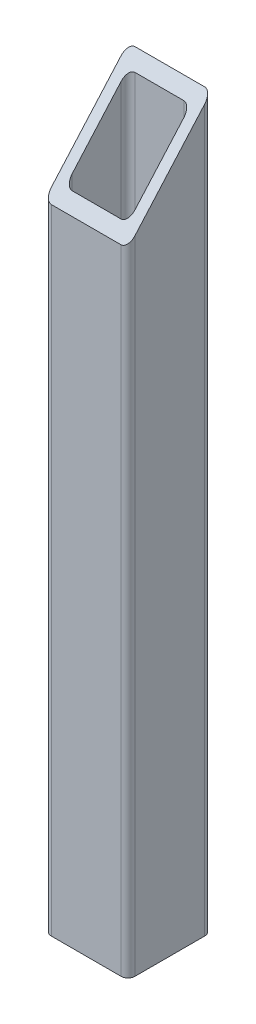
from build123d import *

# Parameters (mm, degrees)
SKETCH1_W           = 25.4
SKETCH1_H           = 25.4
SKETCH1_W_2         = 19.05
SKETCH1_H_2         = 19.05
BOSS_EXTRUDE1_DEPTH = 1219.2
FILLET1_R           = 2.1082
SKETCH2_OUTSIDE_W   = 271.346
SKETCH2_OUTSIDE_H   = 1465.146
SKETCH2_OUTSIDE_W_2 = 161.404490431
SKETCH2_OUTSIDE_H_2 = 228.6
CUT_EXTRUDE1_DEPTH  = 1220.530684321
CUT_EXTRUDE2_DEPTH  = 231.35713577


with BuildPart() as part:
    # Sketch1 → Boss-Extrude1 (new body)
    with BuildSketch(Plane(origin=(0, 0, 0), x_dir=(1, 0, 0), z_dir=(0, 1, 0))):
        Rectangle(SKETCH1_W, SKETCH1_H)
        Rectangle(SKETCH1_W_2, SKETCH1_H_2, mode=Mode.SUBTRACT)
    extrude(amount=BOSS_EXTRUDE1_DEPTH)

    # Fillet1
    fillet1_edges = [part.edges().sort_by_distance(p)[0] for p in [
        (9.525, 609.6, 9.525),
        (9.525, 609.6, -9.525),
        (-9.525, 609.6, -9.525),
        (-9.525, 609.6, 9.525),
        (-12.7, 609.6, -12.7),
        (12.7, 609.6, -12.7),
        (12.7, 609.6, 12.7),
        (-12.7, 609.6, 12.7),
    ]]
    fillet(fillet1_edges, radius=FILLET1_R)

    # Sketch2 outside → Cut-Extrude1 (cut, through all)
    with BuildSketch(Plane(origin=(12.7, 0, 0), x_dir=(0, 0, -1), z_dir=(1, 0, 0))):
        with Locations((0, 609.6)):
            Rectangle(SKETCH2_OUTSIDE_W, SKETCH2_OUTSIDE_H)
        with Locations((42.327264621, 114.3)):
            Rectangle(SKETCH2_OUTSIDE_W_2, SKETCH2_OUTSIDE_H_2, mode=Mode.SUBTRACT)
    extrude(amount=-CUT_EXTRUDE1_DEPTH, mode=Mode.SUBTRACT)

    # Sketch3 → Cut-Extrude2 (cut, through all)
    with BuildSketch(Plane(origin=(12.7, 0, 0), x_dir=(0, 0, -1), z_dir=(1, 0, 0))):
        Polygon((-201.676, 0), (-14.872954341, 211.814744127), (-14.872954341, 228.6), (-0.069750097, 228.6), (15.452852017, 246.200976383), (26.360882017, 236.580998158), (10.838279903, 218.980021775), (-190.76797, -9.619978225), align=None)
    extrude(amount=-CUT_EXTRUDE2_DEPTH, mode=Mode.SUBTRACT)


solid = part.part
